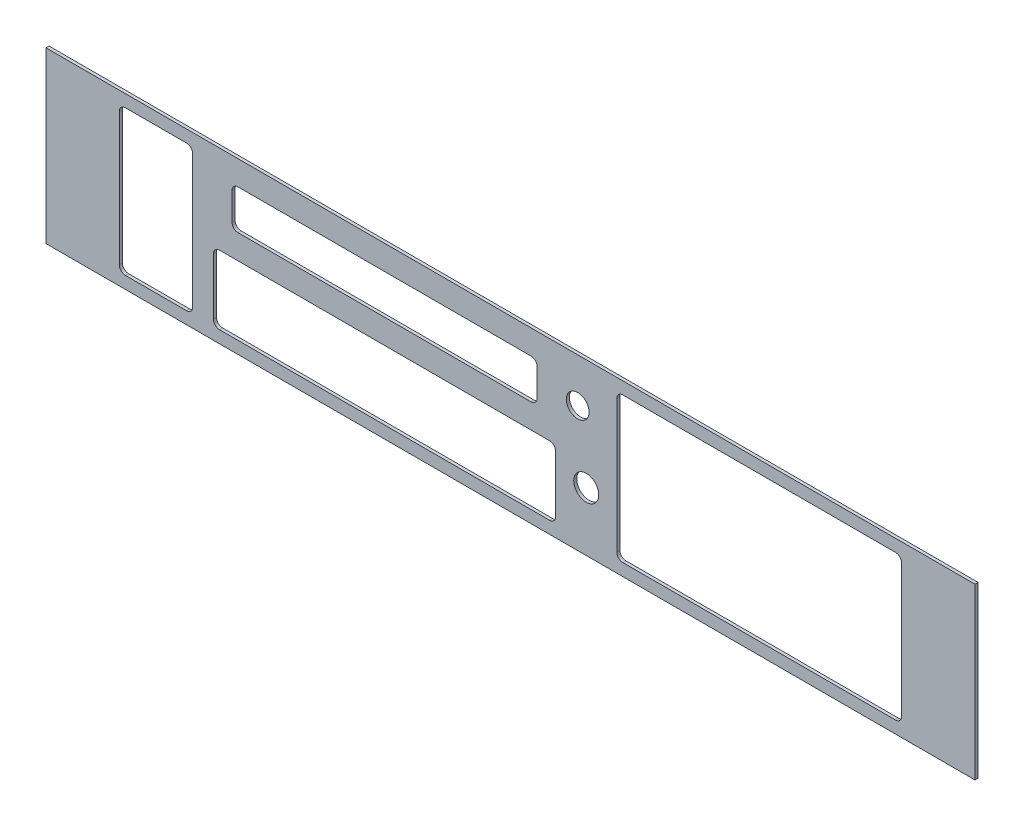
from build123d import *

# Parameters (mm, degrees)
SKETCH1_W           = 482.6
SKETCH1_H           = 88.0999
BOSS_EXTRUDE1_DEPTH = 1.5875
SKETCH2_W           = 158.496
SKETCH2_H           = 20.574
CUT_EXTRUDE1_DEPTH  = 246.292902978
FILLET1_R           = 3.175
SKETCH3_W           = 177.8
SKETCH3_H           = 35.7759
CUT_EXTRUDE2_DEPTH  = 246.292902978
FILLET2_R           = 3.175
SKETCH4_W           = 38.1
SKETCH4_H           = 75.3999
CUT_EXTRUDE3_DEPTH  = 246.292902978
SKETCH5_W           = 147.96262
SKETCH5_H           = 75.3999
CUT_EXTRUDE4_DEPTH  = 1.5875
FILLET3_R           = 3.175
SKETCH6_R           = 6.5024
SKETCH6_R_2         = 5.92074
CUT_EXTRUDE5_DEPTH  = 246.292902978


with BuildPart() as part:
    # Sketch1 → Boss-Extrude1 (new body)
    with BuildSketch(Plane.XY):
        Rectangle(SKETCH1_W, SKETCH1_H)
    extrude(amount=BOSS_EXTRUDE1_DEPTH)

    # Sketch2 → Cut-Extrude1 (cut, through all)
    with BuildSketch(Plane.XY.offset(1.5875)):
        with Locations((-65.41262, 21.06295)):
            Rectangle(SKETCH2_W, SKETCH2_H)
    extrude(amount=-CUT_EXTRUDE1_DEPTH, mode=Mode.SUBTRACT)

    # Fillet1
    fillet1_edges = [part.edges().sort_by_distance(p)[0] for p in [
        (-144.66062, 10.77595, 0.79375),
        (-144.66062, 31.34995, 0.79375),
        (13.83538, 31.34995, 0.79375),
        (13.83538, 10.77595, 0.79375),
    ]]
    fillet(fillet1_edges, radius=FILLET1_R)

    # Sketch3 → Cut-Extrude2 (cut, through all)
    with BuildSketch(Plane.XY.offset(1.5875)):
        with Locations((-65.41262, -19.812)):
            Rectangle(SKETCH3_W, SKETCH3_H)
    extrude(amount=-CUT_EXTRUDE2_DEPTH, mode=Mode.SUBTRACT)

    # Fillet2
    fillet2_edges = [part.edges().sort_by_distance(p)[0] for p in [
        (-154.31262, -37.69995, 0.79375),
        (-154.31262, -1.92405, 0.79375),
        (23.48738, -1.92405, 0.79375),
        (23.48738, -37.69995, 0.79375),
    ]]
    fillet(fillet2_edges, radius=FILLET2_R)

    # Sketch4 → Cut-Extrude3 (cut, through all)
    with BuildSketch(Plane.XY.offset(1.5875)):
        with Locations((-184.15, 0)):
            Rectangle(SKETCH4_W, SKETCH4_H)
    extrude(amount=-CUT_EXTRUDE3_DEPTH, mode=Mode.SUBTRACT)

    # Sketch5 → Cut-Extrude4 (cut)
    with BuildSketch(Plane.XY.offset(1.5875)):
        with Locations((129.21869, 0)):
            Rectangle(SKETCH5_W, SKETCH5_H)
    extrude(amount=-CUT_EXTRUDE4_DEPTH, mode=Mode.SUBTRACT)

    # Fillet3
    fillet3_edges = [part.edges().sort_by_distance(p)[0] for p in [
        (-203.2, -37.69995, 0.79375),
        (-203.2, 37.69995, 0.79375),
        (-165.1, 37.69995, 0.79375),
        (-165.1, -37.69995, 0.79375),
        (55.23738, -37.69995, 0.79375),
        (55.23738, 37.69995, 0.79375),
        (203.2, 37.69995, 0.79375),
        (203.2, -37.69995, 0.79375),
    ]]
    fillet(fillet3_edges, radius=FILLET3_R)

    # Sketch6 → Cut-Extrude5 (cut, through all)
    with BuildSketch(Plane(origin=(0, 0, 0), x_dir=(-1, 0, 0), z_dir=(0, 0, -1))):
        with Locations((-39.36238, -13.56995)):
            Circle(SKETCH6_R)
        with Locations((-34.93008, 21.14042)):
            Circle(SKETCH6_R_2)
    extrude(amount=-CUT_EXTRUDE5_DEPTH, mode=Mode.SUBTRACT)


solid = part.part
